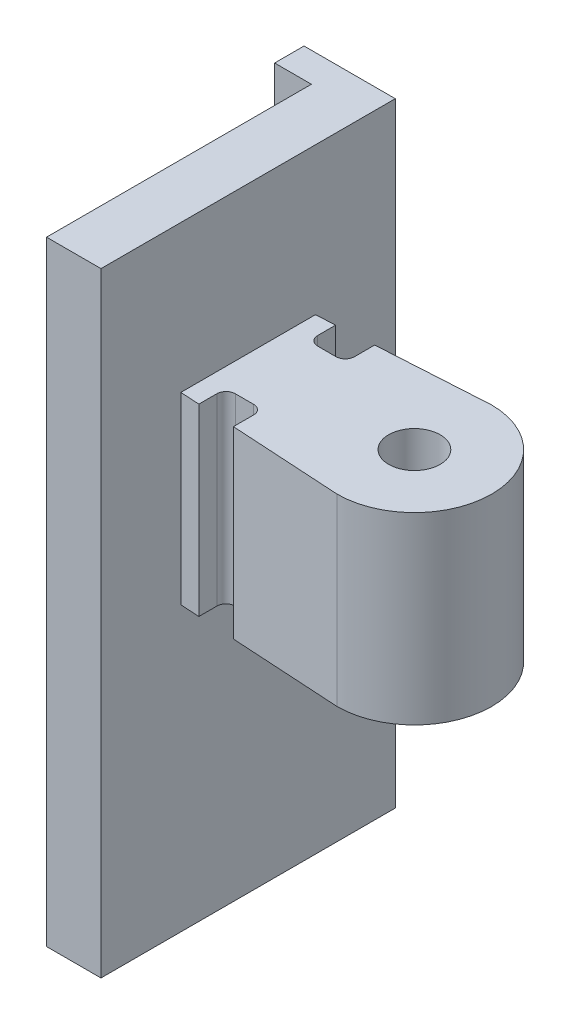
from build123d import *

# Parameters (mm, degrees)
BOSS_EXTRUDE1_DEPTH      = 2.5
SKETCH4_R                = 0.35
THROUGH_HOLES_DEPTH      = 4.688156721
FILLET1_R                = 0.125
BOSS_EXTRUDE4_DEPTH      = 0.5
BOSS_EXTRUDE4_DEPTH_BACK = 0.24
SKETCH11_W               = 4
SKETCH11_H               = 8.35
SKETCH12_W               = 0.4
SKETCH12_H               = 8.35
BOSS_EXTRUDE5_DEPTH      = 0.5


with BuildPart() as part:
    # Sketch3 → Boss-Extrude1 (new body)
    with BuildSketch(Plane(origin=(0, 0, 0), x_dir=(1, 0, 0), z_dir=(0, 1, 0))):
        with BuildLine():
            Line((-2.5, 0.9), (-2, 0.93))
            Line((-2, 0.93), (-2, 0.56))
            Line((-2, 0.56), (-1.5, 0.56))
            Line((-1.5, 0.56), (-1.5, 0.96))
            Line((-1.5, 0.96), (0, 1.05))
            ThreePointArc((0, 1.05), (1.05, 0), (0, -1.05))
            Line((0, -1.05), (-1.5, -0.96))
            Line((-1.5, -0.96), (-1.5, -0.56))
            Line((-1.5, -0.56), (-2, -0.56))
            Line((-2, -0.56), (-2, -0.93))
            Line((-2, -0.93), (-2.5, -0.9))
            Line((-2.5, -0.9), (-2.5, 0.9))
        make_face()
    extrude(amount=BOSS_EXTRUDE1_DEPTH)

    # Sketch4 → Through Holes (cut, through all)
    with BuildSketch(Plane(origin=(0, 2.5, 0), x_dir=(1, 0, 0), z_dir=(0, 1, 0))):
        with Locations(Location((0, 0, 0), (0, 0, 270))):
            Circle(SKETCH4_R)
    extrude(amount=-THROUGH_HOLES_DEPTH, mode=Mode.SUBTRACT)

    # Fillet1
    fillet1_edges = [part.edges().sort_by_distance(p)[0] for p in [
        (-2, 1.25, -0.56),
        (-1.5, 1.25, -0.56),
        (-1.5, 1.25, 0.56),
        (-2, 1.25, 0.56),
    ]]
    fillet(fillet1_edges, radius=FILLET1_R)

    # Sketch11 → Boss-Extrude4 (add, two sides: drawn at the far end of the back side and taken through both)
    with BuildSketch(Plane.ZY.offset(2.5).offset(-BOSS_EXTRUDE4_DEPTH_BACK)):
        with Locations((0, 0.325)):
            Rectangle(SKETCH11_W, SKETCH11_H)
    extrude(amount=BOSS_EXTRUDE4_DEPTH + BOSS_EXTRUDE4_DEPTH_BACK)

    # Sketch12 → Boss-Extrude5 (add)
    with BuildSketch(Plane.ZY.offset(3)):
        with Locations((-1.8, 0.325)):
            Rectangle(SKETCH12_W, SKETCH12_H)
    extrude(amount=BOSS_EXTRUDE5_DEPTH)


solid = part.part
